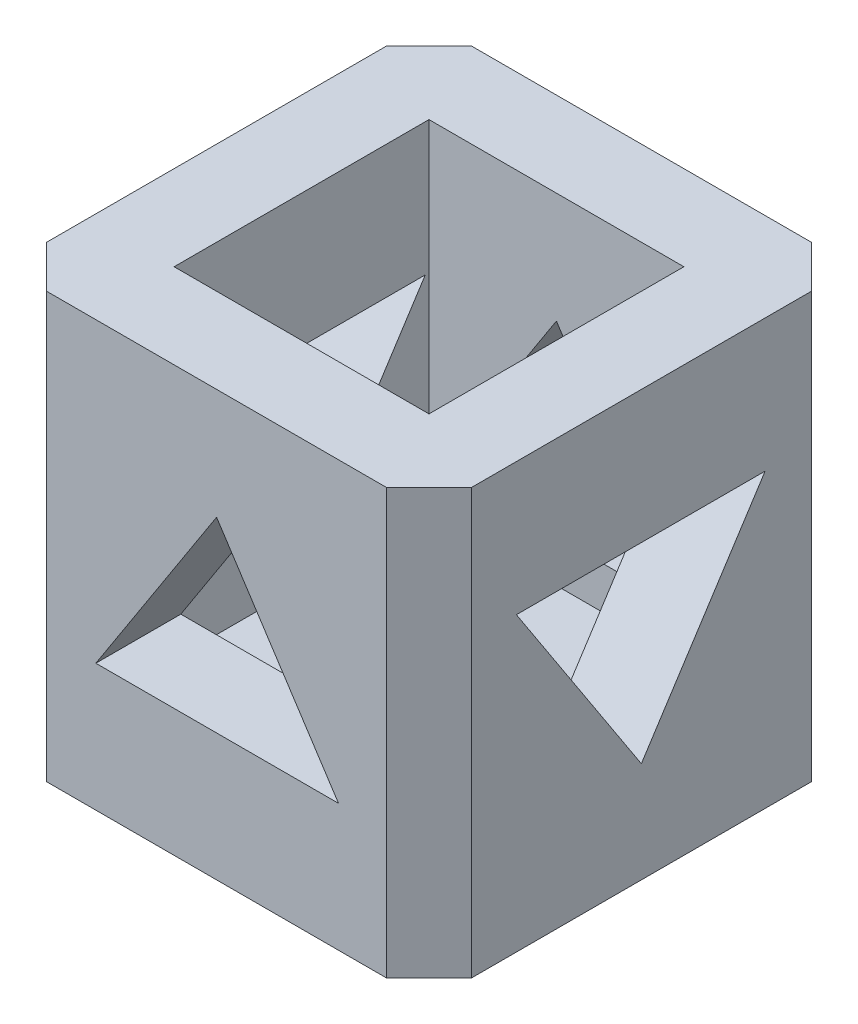
from build123d import *

# Parameters (mm, degrees)
ESQUISSE1_W             = 20
ESQUISSE1_H             = 20
BOSS_EXTRU_1_DEPTH      = 4
ESQUISSE4_W             = 20
ESQUISSE4_H             = 20
ESQUISSE4_W_2           = 12
ESQUISSE4_H_2           = 12
BOSS_EXTRU_2_DEPTH      = 16
ENL_V_MAT_EXTRU_2_DEPTH = 25
ENL_V_MAT_EXTRU_3_DEPTH = 25
CHANFREIN1_SIZE         = 2


with BuildPart() as part:
    # Esquisse1 → Boss.-Extru.1 (new body)
    with BuildSketch(Plane(origin=(0, 0, 0), x_dir=(1, 0, 0), z_dir=(0, 1, 0))):
        Rectangle(ESQUISSE1_W, ESQUISSE1_H)
    extrude(amount=BOSS_EXTRU_1_DEPTH)

    # Esquisse4 → Boss.-Extru.2 (add)
    with BuildSketch(Plane(origin=(0, 4, 0), x_dir=(1, 0, 0), z_dir=(0, 1, 0))):
        Rectangle(ESQUISSE4_W, ESQUISSE4_H)
        Rectangle(ESQUISSE4_W_2, ESQUISSE4_H_2, mode=Mode.SUBTRACT)
    extrude(amount=BOSS_EXTRU_2_DEPTH)

    # Esquisse5 → Enlèv. mat.-Extru.2 (cut)
    with BuildSketch(Plane.XY.offset(10)):
        Polygon((0, 14.786741301), (-5.685006524, 5.991367039), (5.739672743, 5.991367039), align=None)
    extrude(amount=-ENL_V_MAT_EXTRU_2_DEPTH, mode=Mode.SUBTRACT)

    # Esquisse6 → Enlèv. mat.-Extru.3 (cut)
    with BuildSketch(Plane(origin=(10, 0, 0), x_dir=(0, 0, -1), z_dir=(1, 0, 0))):
        Polygon((-0.002312493, 4.739245448), (5.825004197, 13.754790289), (-5.885663837, 13.754790289), align=None)
    extrude(amount=-ENL_V_MAT_EXTRU_3_DEPTH, mode=Mode.SUBTRACT)

    # Chanfrein1
    chanfrein1_edges = [part.edges().sort_by_distance(p)[0] for p in [
        (10, 10, -10),
        (10, 10, 10),
        (-10, 10, 10),
        (-10, 10, -10),
    ]]
    chamfer(chanfrein1_edges, length=CHANFREIN1_SIZE)


solid = part.part
